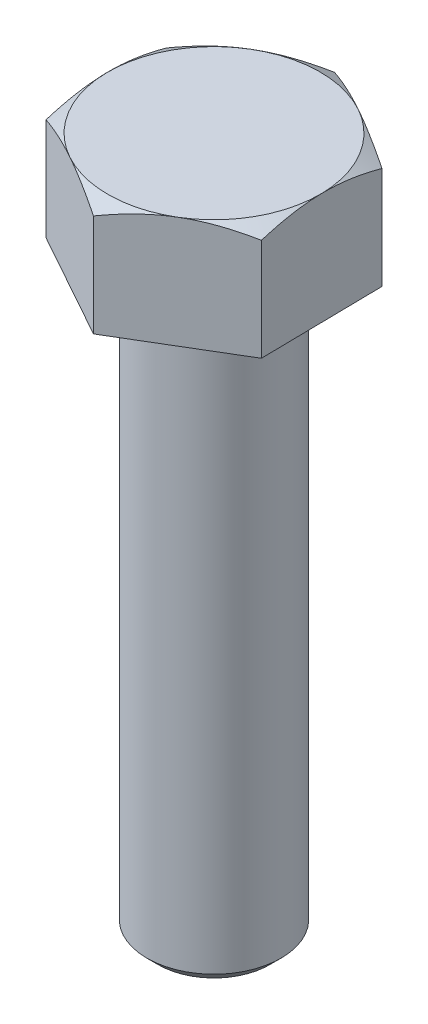
from build123d import *

# Parameters (mm, degrees)
SKETCH2_R           = 6
BOSS_EXTRUDE1_DEPTH = 52
BOSS_EXTRUDE2_DEPTH = 10
SKETCH5_OUTSIDE_W   = 69.512
SKETCH5_OUTSIDE_H   = 72.278
SKETCH5_OUTSIDE_R   = 9.5
CUT_EXTRUDE1_DEPTH  = 10
CUT_EXTRUDE1_DRAFT  = -60
CHAMFER1_SIZE       = 1


with BuildPart() as part:
    # Sketch2 → Boss-Extrude1 (new body)
    with BuildSketch(Plane(origin=(0, 0, 0), x_dir=(1, 0, 0), z_dir=(0, 1, 0))):
        Circle(SKETCH2_R)
    extrude(amount=-BOSS_EXTRUDE1_DEPTH)

    # Sketch3 → Boss-Extrude2 (add)
    with BuildSketch(Plane(origin=(0, 0, 0), x_dir=(1, 0, 0), z_dir=(0, 1, 0))):
        Polygon((9.585446106, -5.334093763), (9.412183758, 5.634192953), (-0.173262348, 10.968286716), (-9.585446106, 5.334093763), (-9.412183758, -5.634192953), (0.173262348, -10.968286716), align=None)
    extrude(amount=BOSS_EXTRUDE2_DEPTH)


with BuildPart() as cut_extrude1_tool:
    # Sketch5 outside → Cut-Extrude1 (with draft: the straight prism first)
    with BuildSketch(Plane(origin=(0, 10, 0), x_dir=(1, 0, 0), z_dir=(0, 1, 0))):
        Rectangle(SKETCH5_OUTSIDE_W, SKETCH5_OUTSIDE_H)
        Circle(SKETCH5_OUTSIDE_R, mode=Mode.SUBTRACT)
    extrude(amount=-CUT_EXTRUDE1_DEPTH)
    # Cut-Extrude1: the draft: its side faces are tilted about the plane it starts from
    cut_extrude1_sides = [cut_extrude1_tool.faces().sort_by_distance(p)[0] for p in [
        (0, 5, 36.139),
        (34.756, 5, 0),
        (0, 5, -36.139),
        (-34.756, 5, 0),
        (-9.5, 5, 0),
    ]]
    draft(cut_extrude1_sides, Plane(origin=(0, 10, 0), x_dir=(1, 0, 0), z_dir=(0, 1, 0)), CUT_EXTRUDE1_DRAFT)


with BuildPart() as part_1:
    add(part.part)

    # Cut-Extrude1: cut by cut_extrude1_tool
    add(cut_extrude1_tool.part, mode=Mode.SUBTRACT)

    # Chamfer1
    chamfer1_edges = [part_1.edges().sort_by_distance(p)[0] for p in [
        (-6, -52, 0),
    ]]
    chamfer(chamfer1_edges, length=CHAMFER1_SIZE)


solid = part_1.part
